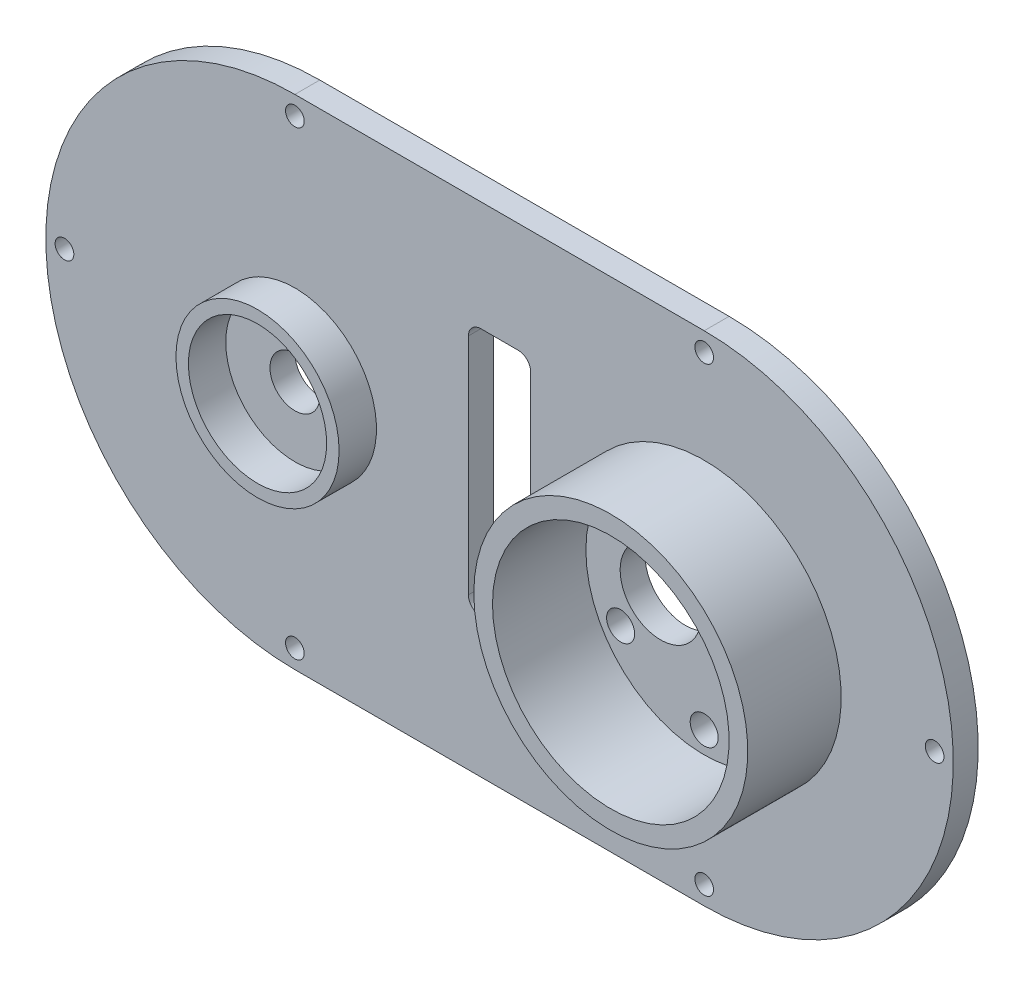
from build123d import *

# Parameters (mm, degrees)
BOSS_EXTRUDE1_DEPTH = 4
SKETCH2_R           = 6.5
SKETCH2_R_2         = 2.25
SKETCH2_R_3         = 4
CUT_EXTRUDE1_DEPTH  = 4
BOSS_EXTRUDE2_START = 4
SKETCH3_R           = 22
SKETCH3_R_2         = 19
BOSS_EXTRUDE2_DEPTH = 15
SKETCH4_R           = 13.1
SKETCH4_R_2         = 11.1
BOSS_EXTRUDE3_DEPTH = 10
SKETCH5_R           = 1.5
CUT_EXTRUDE2_DEPTH  = 103.505675922
SKETCH6_W           = 10
SKETCH6_H           = 40
CUT_EXTRUDE3_DEPTH  = 103.505675922
FILLET1_R           = 2


with BuildPart() as part:
    # Sketch1 → Boss-Extrude1 (new body)
    with BuildSketch(Plane.XY):
        with BuildLine():
            Line((-14.334769336, 37.652327005), (51.395230664, 37.652327005))
            ThreePointArc((51.395230664, 37.652327005), (91.395230664, -2.347672995), (51.395230664, -42.347672995))
            Line((51.395230664, -42.347672995), (-14.334769336, -42.347672995))
            ThreePointArc((-14.334769336, -42.347672995), (-54.334769336, -2.347672995), (-14.334769336, 37.652327005))
        make_face()
    extrude(amount=BOSS_EXTRUDE1_DEPTH)

    # Sketch2 → Cut-Extrude1 (cut)
    with BuildSketch(Plane.XY):
        with Locations(Location((44.395230664, -2.347672995, 0), (0, 0, 180))):
            Circle(SKETCH2_R)
        with Locations(Location((51.395230664, 13.152327005, 0), (0, 0, 180))):
            Circle(SKETCH2_R_2)
        with Locations(Location((64.818624423, 5.402327005, 0), (0, 0, 180))):
            Circle(SKETCH2_R_2)
        with Locations(Location((64.818624423, -10.097672995, 0), (0, 0, 180))):
            Circle(SKETCH2_R_2)
        with Locations(Location((51.395230664, -17.847672995, 0), (0, 0, 180))):
            Circle(SKETCH2_R_2)
        with Locations(Location((37.971836906, -10.097672995, 0), (0, 0, 180))):
            Circle(SKETCH2_R_2)
        with Locations(Location((37.971836906, 5.402327005, 0), (0, 0, 180))):
            Circle(SKETCH2_R_2)
        with Locations(Location((-14.334769336, -2.347672995, 0), (0, 0, 180))):
            Circle(SKETCH2_R_3)
    extrude(amount=CUT_EXTRUDE1_DEPTH, mode=Mode.SUBTRACT)

    # Sketch3 → Boss-Extrude2 (add)
    with BuildSketch(Plane.XY.offset(BOSS_EXTRUDE2_START)):
        with Locations(Location((51.395230664, -2.347672995, 0), (0, 0, 180))):
            Circle(SKETCH3_R)
        with Locations(Location((51.395230664, -2.347672995, 0), (0, 0, 180))):
            Circle(SKETCH3_R_2, mode=Mode.SUBTRACT)
    extrude(amount=BOSS_EXTRUDE2_DEPTH)

    # Sketch4 → Boss-Extrude3 (add)
    with BuildSketch(Plane.XY):
        with Locations(Location((-14.334769336, -2.347672995, 0), (0, 0, 180))):
            Circle(SKETCH4_R)
        with Locations(Location((-14.334769336, -2.347672995, 0), (0, 0, 180))):
            Circle(SKETCH4_R_2, mode=Mode.SUBTRACT)
    extrude(amount=BOSS_EXTRUDE3_DEPTH)

    # Sketch5 → Cut-Extrude2 (cut, through all)
    with BuildSketch(Plane.XY):
        with Locations(Location((88.395230664, -2.347672995, 0), (0, 0, 180))):
            Circle(SKETCH5_R)
        with Locations(Location((-51.334769336, -2.347672995, 0), (0, 0, 180))):
            Circle(SKETCH5_R)
        with Locations(Location((51.395230664, 34.652327005, 0), (0, 0, 180))):
            Circle(SKETCH5_R)
        with Locations(Location((51.395230664, -39.347672995, 0), (0, 0, 180))):
            Circle(SKETCH5_R)
        with Locations(Location((-14.334769336, -39.347672995, 0), (0, 0, 180))):
            Circle(SKETCH5_R)
        with Locations(Location((-14.334769336, 34.652327005, 0), (0, 0, 180))):
            Circle(SKETCH5_R)
    extrude(amount=CUT_EXTRUDE2_DEPTH, mode=Mode.SUBTRACT)

    # Sketch6 → Cut-Extrude3 (cut, through all)
    with BuildSketch(Plane.XY):
        with Locations((18.530230664, 0)):
            Rectangle(SKETCH6_W, SKETCH6_H)
    extrude(amount=CUT_EXTRUDE3_DEPTH, mode=Mode.SUBTRACT)

    # Fillet1
    fillet1_edges = [part.edges().sort_by_distance(p)[0] for p in [
        (23.530230664, -20, 2),
        (23.530230664, 20, 2),
        (13.530230664, 20, 2),
        (13.530230664, -20, 2),
    ]]
    fillet(fillet1_edges, radius=FILLET1_R)


solid = part.part
